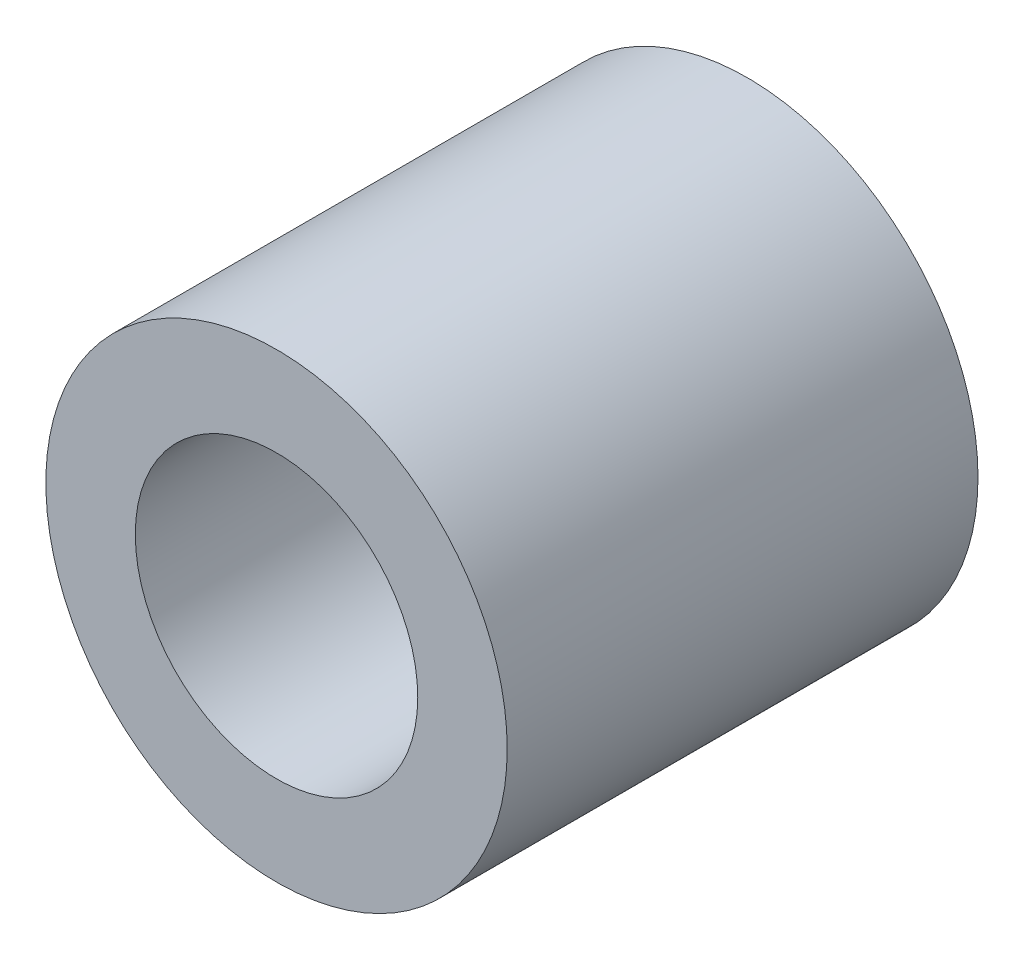
from build123d import *

# Parameters (mm, degrees)
SKETCH2_R           = 4.9
SKETCH2_R_2         = 3
BOSS_EXTRUDE1_DEPTH = 10
SKETCH2_3_R         = 3
SKETCH2_3_R_2       = 1.8
BOSS_EXTRUDE2_DEPTH = 3


with BuildPart() as part:
    # Sketch2 → Boss-Extrude1 (new body)
    with BuildSketch(Plane.XY):
        with Locations((24.418828758, 6)):
            Circle(SKETCH2_R)
        with Locations((24.418828758, 6)):
            Circle(SKETCH2_R_2, mode=Mode.SUBTRACT)
    extrude(amount=BOSS_EXTRUDE1_DEPTH)

    # Sketch2<3> → Boss-Extrude2 (add)
    with BuildSketch(Plane.XY):
        with Locations((24.418828758, 6)):
            Circle(SKETCH2_3_R)
        with Locations((24.418828758, 6)):
            Circle(SKETCH2_3_R_2, mode=Mode.SUBTRACT)
    extrude(amount=BOSS_EXTRUDE2_DEPTH)


solid = part.part
